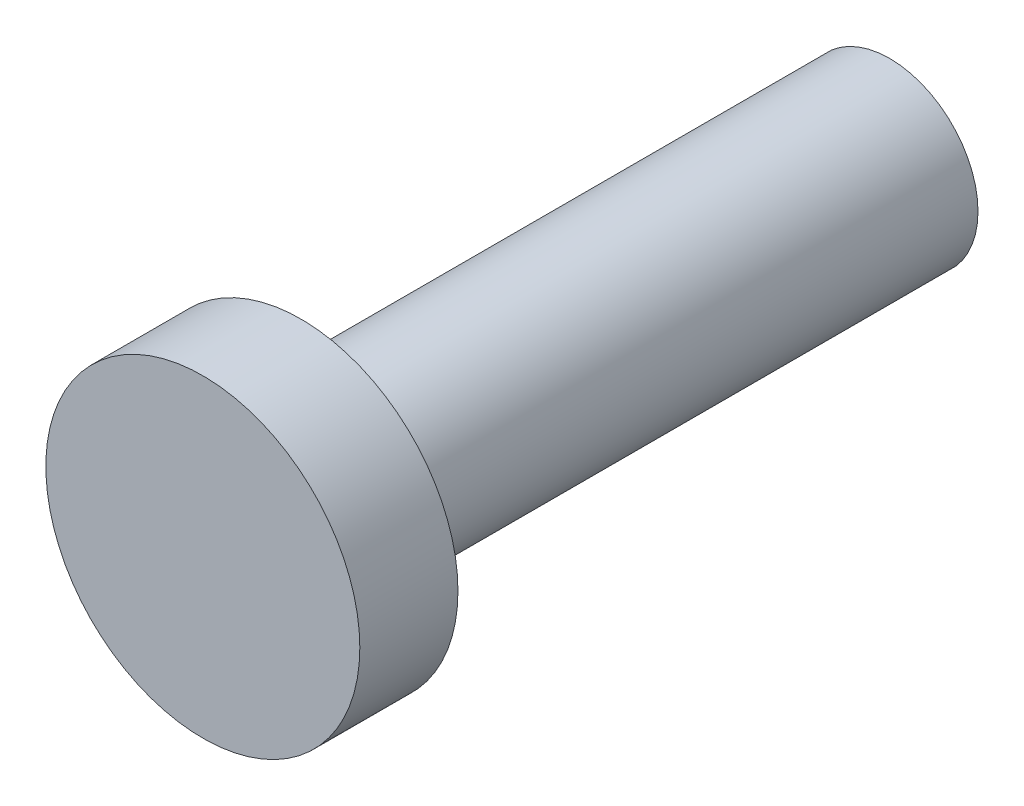
from build123d import *

# Parameters (mm, degrees)
ESBO_O1_R                = 4.5
RESSALTO_EXTRUS_O2_DEPTH = 30
ESBO_O5_R                = 8
RESSALTO_EXTRUS_O4_DEPTH = 5


with BuildPart() as part:
    # Esboço1 → Ressalto-extrusão2 (new body)
    with BuildSketch(Plane.XY):
        Circle(ESBO_O1_R)
    extrude(amount=RESSALTO_EXTRUS_O2_DEPTH)

    # Esboço5 → Ressalto-extrusão4 (add)
    with BuildSketch(Plane.XY.offset(30)):
        Circle(ESBO_O5_R)
    extrude(amount=RESSALTO_EXTRUS_O4_DEPTH)


solid = part.part
